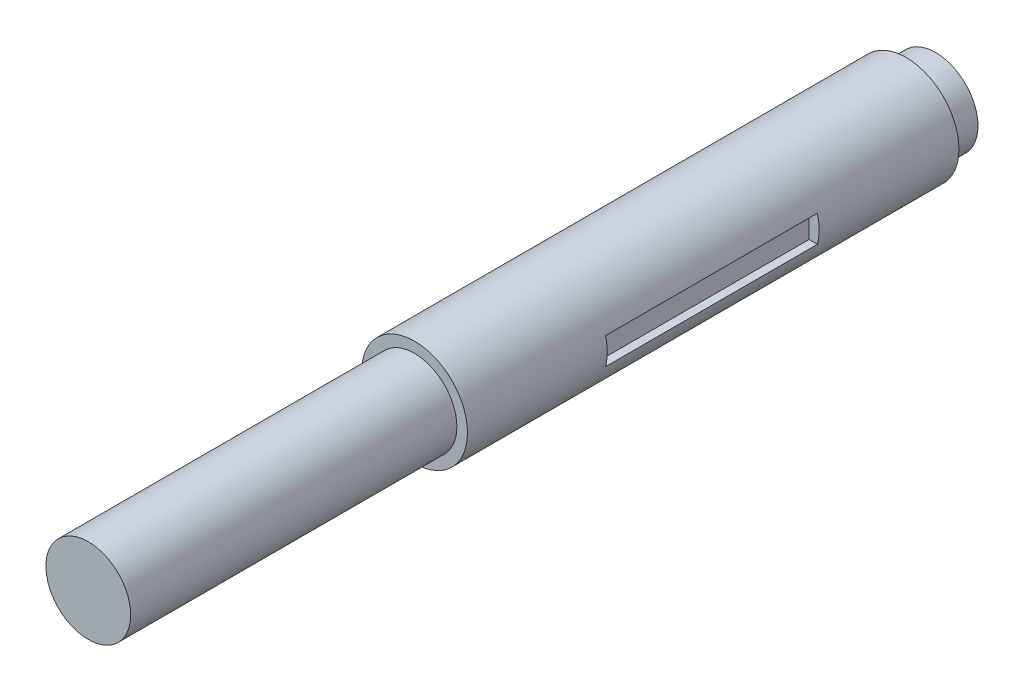
from build123d import *

# Parameters (mm, degrees)
SKETCH1_R           = 12.5
BOSS_EXTRUDE1_DEPTH = 116
SKETCH2_R           = 10
BOSS_EXTRUDE2_DEPTH = 7
BOSS_EXTRUDE3_START = 7
SKETCH3_R           = 10
BOSS_EXTRUDE3_DEPTH = 7
SKETCH4_W           = 50
SKETCH4_H           = 6.35
CUT_EXTRUDE1_DEPTH  = 2.38125
SKETCH6_R           = 10
BOSS_EXTRUDE4_DEPTH = 70


with BuildPart() as part:
    # Sketch1 → Boss-Extrude1 (new body)
    with BuildSketch(Plane.XY):
        with Locations(Location((0, 0, 0), (0, 0, 180))):
            Circle(SKETCH1_R)
    extrude(amount=BOSS_EXTRUDE1_DEPTH)

    # Sketch2 → Boss-Extrude2 (add)
    with BuildSketch(Plane.XY.offset(116)):
        Circle(SKETCH2_R)
    extrude(amount=BOSS_EXTRUDE2_DEPTH)

    # Sketch3 → Boss-Extrude3 (add)
    with BuildSketch(Plane(origin=(0, 0, 0), x_dir=(-1, 0, 0), z_dir=(0, 0, -1)).offset(BOSS_EXTRUDE3_START)):
        with Locations(Location((0, 0, 0), (0, 0, 180))):
            Circle(SKETCH3_R)
    extrude(amount=-BOSS_EXTRUDE3_DEPTH)

    # Sketch4 → Cut-Extrude1 (cut)
    with BuildSketch(Plane(origin=(12.5, 0, 0), x_dir=(0, 0, -1), z_dir=(1, 0, 0))):
        with Locations((-58, 0)):
            Rectangle(SKETCH4_W, SKETCH4_H)
    extrude(amount=-CUT_EXTRUDE1_DEPTH, mode=Mode.SUBTRACT)

    # Sketch6 → Boss-Extrude4 (add)
    with BuildSketch(Plane.XY.offset(123)):
        Circle(SKETCH6_R)
    extrude(amount=BOSS_EXTRUDE4_DEPTH)


solid = part.part
